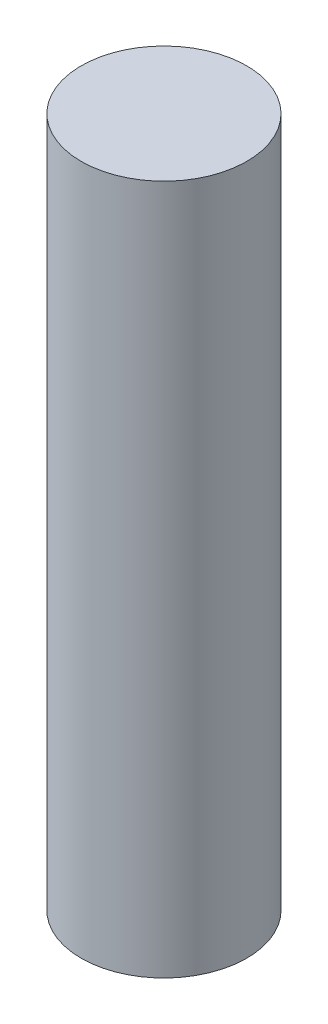
from build123d import *

# Parameters (mm, degrees)
SKETCH2_R           = 6
BOSS_EXTRUDE1_DEPTH = 50


with BuildPart() as part:
    # Sketch2 → Boss-Extrude1 (new body)
    with BuildSketch(Plane(origin=(0, 0, 0), x_dir=(1, 0, 0), z_dir=(0, 1, 0))):
        with Locations(Location((0, 0, 0), (0, 0, 270))):
            Circle(SKETCH2_R)
    extrude(amount=BOSS_EXTRUDE1_DEPTH)


solid = part.part
